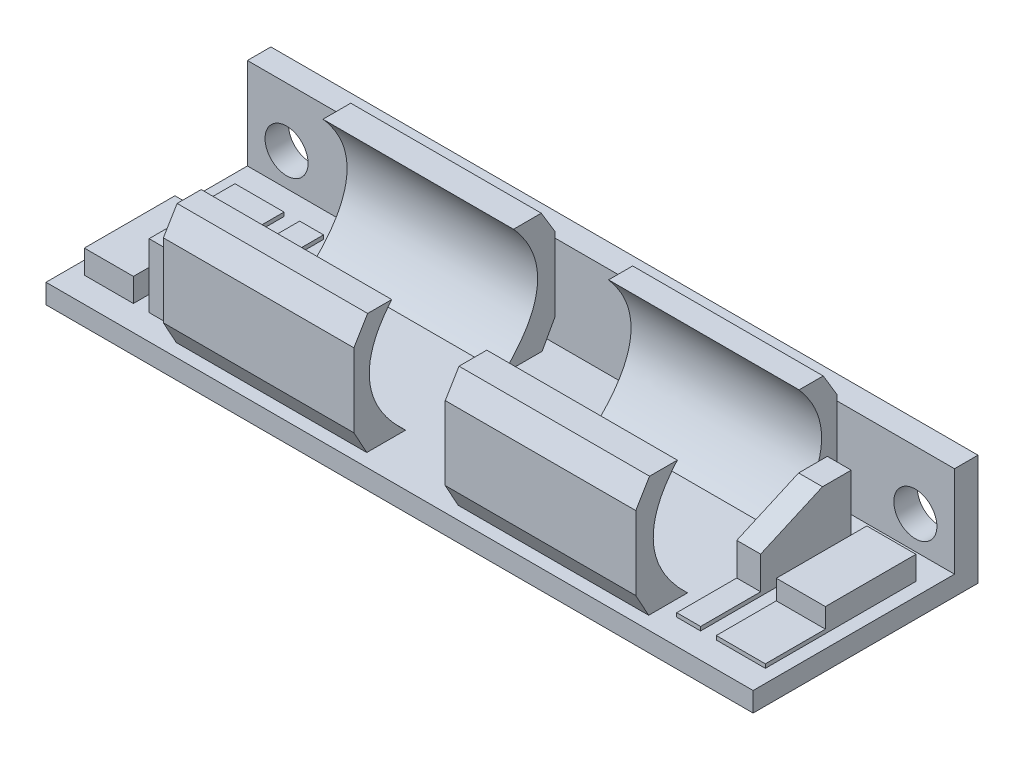
from build123d import *

# Parameters (mm, degrees)
SKETCH_1_W               = 23.59
SKETCH_1_H               = 12.34
EXTRUDE_1_DEPTH          = 1
SKETCH_1_3_W             = 14.6
SKETCH_1_3_H             = 2.72
SKETCH_1_3_W_2           = 3.76
SKETCH_1_3_H_2           = 11.54
SKETCH_1_3_W_3           = 1.83
EXTRUDE_2_DEPTH          = 10
EXTRUDE_3_DEPTH          = 14.6
CUT_EXTRUDE_1_DEPTH      = 14.6
CUT_EXTRUDE_2_DEPTH      = 14.6
CUT_EXTRUDE_3_DEPTH      = 14.6
PATTERN_CIRCULAR_1_COUNT = 2
SKETCH_7_W               = 20.64829466
SKETCH_7_H               = 2.860597992
CUT_EXTRUDE_4_DEPTH      = 38.6
SKETCH_8_R               = 1.6
EXTRUDE_4_DEPTH          = 1.5
SKETCH_9_W               = 54.18
SKETCH_9_H               = 1.8
EXTRUDE_5_DEPTH          = 7
SKETCH_10_R              = 1.65
CUT_EXTRUDE_5_DEPTH      = 5
EXTRUDE_START            = 2
SKETCH_8_3_W             = 7
SKETCH_8_3_H             = 4.5
SKETCH_8_3_R             = 1.6
EXTRUDE_6_DEPTH          = 2
SKETCH_11_W              = 54.18
SKETCH_11_H              = 6.653379434
CUT_EXTRUDE_6_DEPTH      = 5


with BuildPart() as part:
    # 草图1 → 凸台-拉伸1 (new body)
    with BuildSketch(Plane(origin=(0, 0, 0), x_dir=(1, 0, 0), z_dir=(0, 1, 0))):
        with Locations((4.192, 0)):
            Rectangle(SKETCH_1_W, SKETCH_1_H)
    extrude(amount=-EXTRUDE_1_DEPTH)

    # 草图1<3> → 凸台-拉伸2 (add)
    with BuildSketch(Plane(origin=(0, 0, 0), x_dir=(1, 0, 0), z_dir=(0, 1, 0))):
        with Locations((8.687, 4.81)):
            Rectangle(SKETCH_1_3_W, SKETCH_1_3_H)
        with Locations((8.687, -4.81)):
            Rectangle(SKETCH_1_3_W, SKETCH_1_3_H)
        with Locations((-4.723, 0)):
            Rectangle(SKETCH_1_3_W_2, SKETCH_1_3_H_2)
        with Locations((-0.728, 0)):
            Rectangle(SKETCH_1_3_W_3, SKETCH_1_3_H_2)
    extrude(amount=EXTRUDE_2_DEPTH)

    # 草图4 → 凸台-拉伸3 (add)
    with BuildSketch(Plane(origin=(15.987, 0, 0), x_dir=(0, 0, -1), z_dir=(1, 0, 0))):
        Polygon((6.17, 10), (7.707580576, 7.443577481), (7.707580576, 1.805314446), (6.17, -1), align=None)
        Polygon((-7.707580576, 1.805314446), (-6.17, -1), (-6.17, 10), (-7.707580576, 7.443577481), align=None)
    extrude(amount=-EXTRUDE_3_DEPTH)

    # 草图3 → 切除-拉伸1 (cut)
    with BuildSketch(Plane(origin=(15.987, 0, 0), x_dir=(0, 0, -1), z_dir=(1, 0, 0))):
        with BuildLine():
            Line((3.45, 0), (3.743222721, 0))
            add(Edge.make_bspline(
                [(3.743222721, 0), (3.911611309, 0.15963804), (4.29393083, 0.539845441), (4.994683036, 1.333496486), (5.723480991, 2.402845903), (6.251271172, 3.695549278), (6.429364414, 5), (6.251271172, 6.304450722), (5.723480991, 7.597154097), (4.994683036, 8.666503514), (4.253106755, 9.506390689), (3.815688064, 9.935054209), (3.597380816, 10.136172737)],
                knots=[0.014828564, 0.014828564, 0.014828564, 0.014828564, 0.0625, 0.125, 0.25, 0.375, 0.5, 0.625, 0.75, 0.875, 0.9375, 0.998871937, 0.998871937, 0.998871937, 0.998871937], degree=3))
            Line((3.597380816, 10.136172737), (3.45, 10))
            Line((3.45, 10), (3.45, 0))
        make_face()
        with BuildLine():
            Line((-3.45, 0), (-3.743222721, 0))
            add(Edge.make_bspline(
                [(-3.743222721, 0), (-3.781981306, 0.035623699), (-3.849464206, 0.098316559), (-4.072000203, 0.30899054), (-4.461726475, 0.698324492), (-5.152564834, 1.48074741), (-5.881362789, 2.550096827), (-6.40915297, 3.842800202), (-6.587246212, 5.147250924), (-6.40915297, 6.451701646), (-5.881362789, 7.744405021), (-5.152564834, 8.813754438), (-4.461708764, 9.596197415), (-4.071967827, 9.985543512), (-3.84942965, 10.196217487), (-3.781968617, 10.258889811), (-3.743222721, 10.294501848)],
                knots=[0, 0, 0, 0, 0.010893382, 0.018155637, 0.0625, 0.125, 0.25, 0.375, 0.5, 0.625, 0.75, 0.875, 0.9375, 0.981850307, 0.989110184, 1, 1, 1, 1], degree=3))
            Line((-3.743222721, 10.294501848), (-3.45, 10))
            Line((-3.45, 10), (-3.45, 0))
        make_face()
    extrude(amount=-CUT_EXTRUDE_1_DEPTH, mode=Mode.SUBTRACT)

    # 草图5 → 切除-拉伸2 (cut)
    with BuildSketch(Plane(origin=(0.187, 0, 0), x_dir=(0, 0, -1), z_dir=(1, 0, 0))):
        Polygon((1.17, 2.8), (-3.569711506, 4.901860767), (-5.77, 4.901860767), (-5.77, 10), (5.77, 10), (5.77, 0.3), (1.17, 0.3), align=None)
    extrude(amount=-CUT_EXTRUDE_2_DEPTH, mode=Mode.SUBTRACT)

    # 草图6 → 切除-拉伸3 (cut)
    with BuildSketch(Plane(origin=(-2.843, 0, 0), x_dir=(0, 0, -1), z_dir=(1, 0, 0))):
        Polygon((1.17, 5.538552109), (1.17, 1.8), (-3.795527251, 1.8), (-5.77, 1.8), (-5.77, 5.538552109), align=None)
    extrude(amount=-CUT_EXTRUDE_3_DEPTH, mode=Mode.SUBTRACT)


with BuildPart() as pattern_circular_1_1:
    # 阵列(圆周)1: pattern copy
    add(part.part.rotate(Axis((19.487, -1.5500525, 0), (0, 1, 0)), 1 * 360 / PATTERN_CIRCULAR_1_COUNT))


with BuildPart() as cut_extrude_4_tool:
    # 草图7 → 切除-拉伸4 (new body)
    with BuildSketch(Plane.ZY.offset(-1.387)):
        with Locations((-0.112362095, 10.62761907)):
            Rectangle(SKETCH_7_W, SKETCH_7_H)
    extrude(amount=-CUT_EXTRUDE_4_DEPTH)


with BuildPart() as part_1:
    add(part.part)

    # 切除-拉伸4: cut by cut_extrude_4_tool
    add(cut_extrude_4_tool.part, mode=Mode.SUBTRACT)



with BuildPart() as pattern_circular_1_1_1:
    add(pattern_circular_1_1.part)

    # 切除-拉伸4: cut by cut_extrude_4_tool
    add(cut_extrude_4_tool.part, mode=Mode.SUBTRACT)


with BuildPart() as part_2:
    add(part_1.part)

    add(pattern_circular_1_1_1.part)  # 凸台-拉伸4 merges 阵列(圆周)1_1
    # 草图8 → 凸台-拉伸4 (add)
    with BuildSketch(Plane(origin=(0, 0, 0), x_dir=(1, 0, 0), z_dir=(0, 1, 0))):
        Polygon((22.987, -9.524287518), (46.577, -9.524287518), (46.577, 9.524287518), (22.987, 9.524287518), (22.987, 14.024287518), (15.987, 14.024287518), (15.987, 9.524287518), (-7.603, 9.524287518), (-7.603, -9.524287518), (15.987, -9.524287518), (15.987, -14.024287518), (22.987, -14.024287518), align=None)
        with Locations((19.487, -11.774287518)):
            Circle(SKETCH_8_R, mode=Mode.SUBTRACT)
        with Locations((19.487, 11.774287518)):
            Circle(SKETCH_8_R, mode=Mode.SUBTRACT)
    extrude(amount=-EXTRUDE_4_DEPTH)

    # 草图9 → 凸台-拉伸5 (add)
    with BuildSketch(Plane(origin=(0, 0, 0), x_dir=(1, 0, 0), z_dir=(0, 1, 0))):
        with Locations((19.487, 8.624287518)):
            Rectangle(SKETCH_9_W, SKETCH_9_H)
    extrude(amount=EXTRUDE_5_DEPTH)

    # 草图10 → 切除-拉伸5 (cut)
    with BuildSketch(Plane.XY.offset(-7.724287518)):
        with Locations((-4.603, 2.5)):
            Circle(SKETCH_10_R)
        with Locations((43.577, 2.5)):
            Circle(SKETCH_10_R)
    extrude(amount=-CUT_EXTRUDE_5_DEPTH, mode=Mode.SUBTRACT)

    # 草图8<3> → 凸台-拉伸6 (add)
    # profile 1 of 2: a face of its own
    with BuildSketch(Plane(origin=(0, 0, 0), x_dir=(1, 0, 0), z_dir=(0, 1, 0)).offset(EXTRUDE_START)):
        with Locations((19.487, -11.774287518)):
            Rectangle(SKETCH_8_3_W, SKETCH_8_3_H)
        with Locations((19.487, -11.774287518)):
            Circle(SKETCH_8_3_R, mode=Mode.SUBTRACT)
    # profile 2 of 2: a face of its own
    with BuildSketch(Plane(origin=(0, 0, 0), x_dir=(1, 0, 0), z_dir=(0, 1, 0)).offset(EXTRUDE_START)):
        with Locations((19.487, 11.774287518)):
            Rectangle(SKETCH_8_3_W, SKETCH_8_3_H)
        with Locations((19.487, 11.774287518)):
            Circle(SKETCH_8_3_R, mode=Mode.SUBTRACT)
    extrude(amount=-EXTRUDE_6_DEPTH)

    # 草图11 → 切除-拉伸6 (cut, symmetric)
    with BuildSketch(Plane(origin=(0, 0, 0), x_dir=(1, 0, 0), z_dir=(0, 1, 0))):
        with Locations((19.487, -11.034270293)):
            Rectangle(SKETCH_11_W, SKETCH_11_H)
    extrude(amount=CUT_EXTRUDE_6_DEPTH, both=True, mode=Mode.SUBTRACT)


solid = part_2.part
